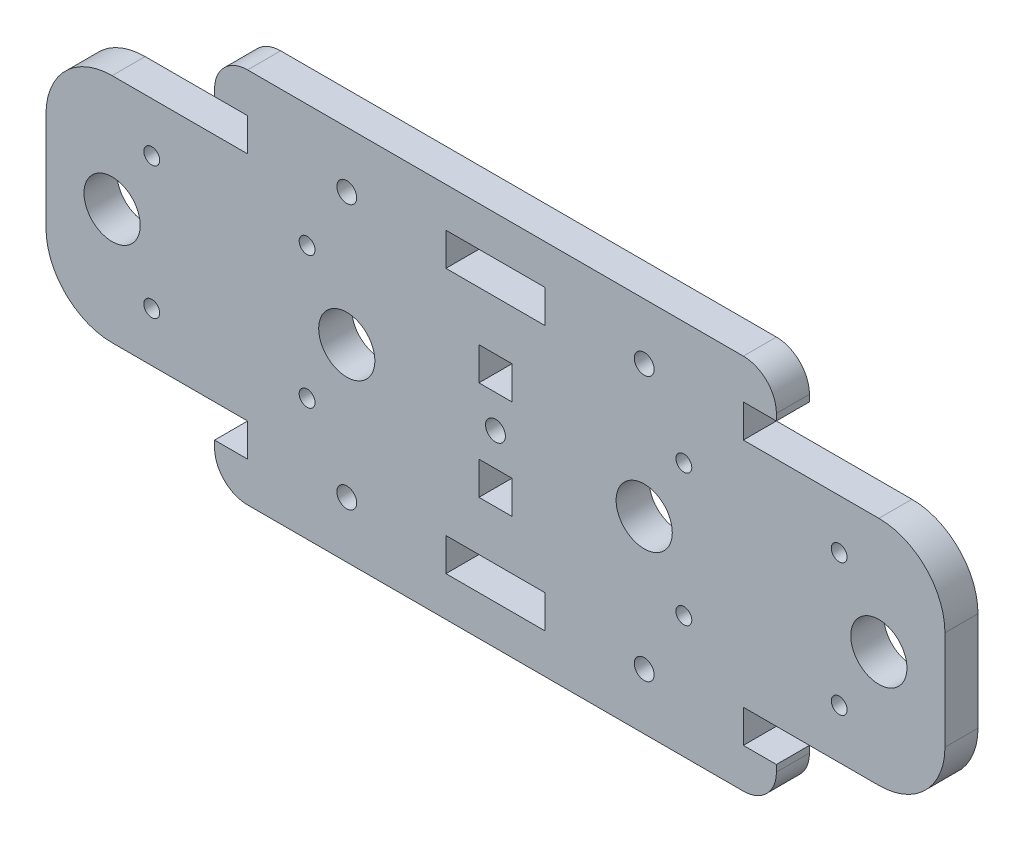
from build123d import *

# Parameters (mm, degrees)
ESQUISSE1_R        = 1.5
ESQUISSE1_R_2      = 4.25
ESQUISSE1_R_3      = 1.2
ESQUISSE1_W        = 5
ESQUISSE1_H        = 5
BOSS_EXTRU_1_DEPTH = 5
CONG_1_R           = 5
CONG_2_R           = 10


with BuildPart() as part:
    # Esquisse1 → Boss.-Extru.1 (new body)
    with BuildSketch(Plane.XY):
        Polygon((-20, 0), (20, 0), (20, 6), (15, 6), (15, 11), (20, 11), (45.5, 11), (45.5, 46), (20, 46), (15, 46), (15, 51), (20, 51), (20, 57), (-20, 57), (-25, 57), (-65, 57), (-65, 51), (-60, 51), (-60, 46), (-65, 46), (-90.5, 46), (-90.5, 11), (-65, 11), (-60, 11), (-60, 6), (-65, 6), (-65, 0), (-25, 0), align=None)
        with Locations((0, 48.5)):
            Circle(ESQUISSE1_R, mode=Mode.SUBTRACT)
        with Locations((0, 8.5)):
            Circle(ESQUISSE1_R, mode=Mode.SUBTRACT)
        with Locations((0, 28.5)):
            Circle(ESQUISSE1_R_2, mode=Mode.SUBTRACT)
        with Locations(Location((-45, 8.5, 0), (0, 0, 180))):
            Circle(ESQUISSE1_R, mode=Mode.SUBTRACT)
        with Locations(Location((-45, 28.5, 0), (0, 0, 180))):
            Circle(ESQUISSE1_R_2, mode=Mode.SUBTRACT)
        with Locations(Location((-45, 48.5, 0), (0, 0, 180))):
            Circle(ESQUISSE1_R, mode=Mode.SUBTRACT)
        with Locations((6, 38.5)):
            Circle(ESQUISSE1_R_3, mode=Mode.SUBTRACT)
        with Locations(Location((6, 18.5, 0), (0, 0, 180))):
            Circle(ESQUISSE1_R_3, mode=Mode.SUBTRACT)
        with Locations((-51, 18.5)):
            Circle(ESQUISSE1_R_3, mode=Mode.SUBTRACT)
        with Locations(Location((-51, 38.5, 0), (0, 0, 180))):
            Circle(ESQUISSE1_R_3, mode=Mode.SUBTRACT)
        with Locations((35.5, 28.5)):
            Circle(ESQUISSE1_R_2, mode=Mode.SUBTRACT)
        with Locations(Location((-80.5, 28.5, 0), (0, 0, 180))):
            Circle(ESQUISSE1_R_2, mode=Mode.SUBTRACT)
        with Locations((29.5, 38.5)):
            Circle(ESQUISSE1_R_3, mode=Mode.SUBTRACT)
        with Locations(Location((29.5, 18.5, 0), (0, 0, 180))):
            Circle(ESQUISSE1_R_3, mode=Mode.SUBTRACT)
        with Locations((-74.5, 18.5)):
            Circle(ESQUISSE1_R_3, mode=Mode.SUBTRACT)
        with Locations(Location((-74.5, 38.5, 0), (0, 0, 180))):
            Circle(ESQUISSE1_R_3, mode=Mode.SUBTRACT)
        with Locations((-22.5, 28.5)):
            Circle(ESQUISSE1_R, mode=Mode.SUBTRACT)
        Polygon((-20, 51), (-15, 51), (-15, 46), (-20, 46), (-25, 46), (-30, 46), (-30, 51), (-25, 51), align=None, mode=Mode.SUBTRACT)
        Polygon((-20, 11), (-15, 11), (-15, 6), (-20, 6), (-25, 6), (-30, 6), (-30, 11), (-25, 11), align=None, mode=Mode.SUBTRACT)
        with Locations((-22.5, 21)):
            Rectangle(ESQUISSE1_W, ESQUISSE1_H, mode=Mode.SUBTRACT)
        with Locations((-22.5, 36)):
            Rectangle(ESQUISSE1_W, ESQUISSE1_H, mode=Mode.SUBTRACT)
    extrude(amount=BOSS_EXTRU_1_DEPTH)

    # Congé1
    cong_1_edges = [part.edges().sort_by_distance(p)[0] for p in [
        (-65, 0, 2.5),
        (-65, 57, 2.5),
        (20, 57, 2.5),
        (20, 0, 2.5),
    ]]
    fillet(cong_1_edges, radius=CONG_1_R)

    # Congé2
    cong_2_edges = [part.edges().sort_by_distance(p)[0] for p in [
        (-90.5, 11, 2.5),
        (-90.5, 46, 2.5),
        (45.5, 46, 2.5),
        (45.5, 11, 2.5),
    ]]
    fillet(cong_2_edges, radius=CONG_2_R)


solid = part.part
